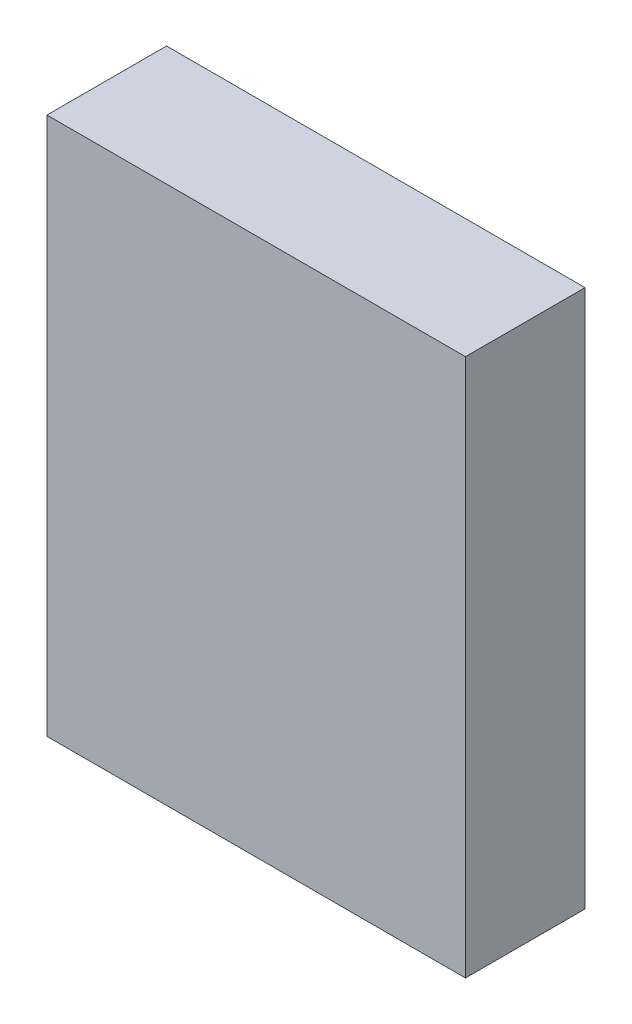
from build123d import *

# Parameters (mm, degrees)
SKETCH_1_W      = 70
SKETCH_1_H      = 90
EXTRUDE_1_DEPTH = 20


with BuildPart() as part:
    # 草图1 → 凸台-拉伸1 (new body)
    with BuildSketch(Plane.XY):
        Rectangle(SKETCH_1_W, SKETCH_1_H)
    extrude(amount=EXTRUDE_1_DEPTH)


solid = part.part
